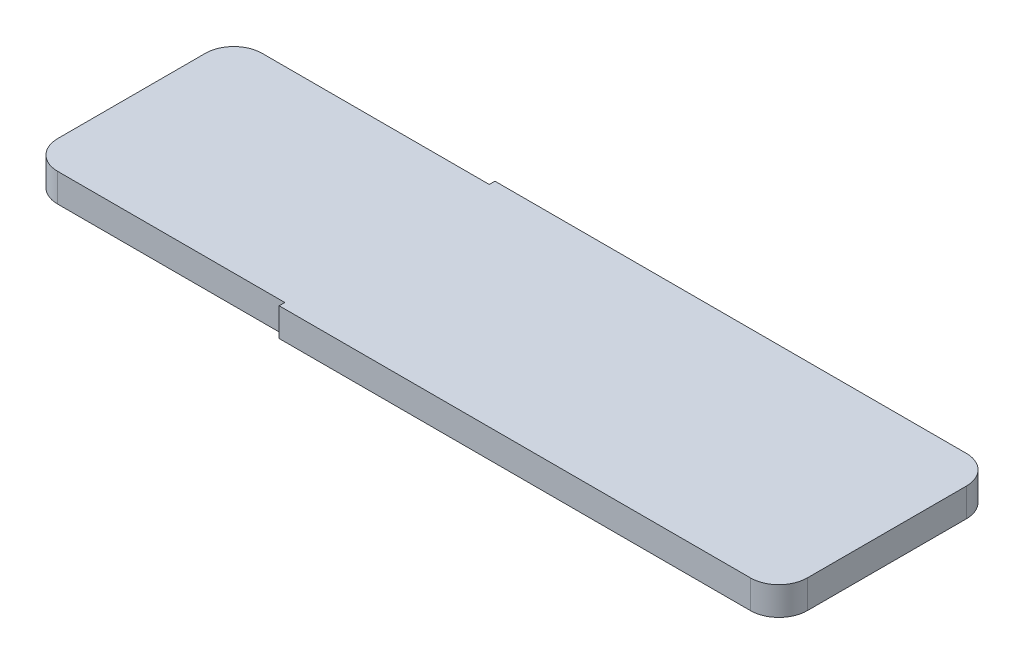
from build123d import *

# Parameters (mm, degrees)
EXTRUDE_473_DEPTH = 5
FILLET_R_R        = 10


with BuildPart() as part:
    # ｽｹｯﾁ1 → Extrude 473 (new, symmetric)
    with BuildSketch(Plane(origin=(0, 0, 0), x_dir=(1, 0, 0), z_dir=(0, 1, 0))):
        Polygon((-166, 36), (-76, 36), (-76, 38), (100, 38), (100, -38), (-76, -38), (-76, -36), (-166, -36), align=None)
    extrude(amount=EXTRUDE_473_DEPTH, both=True)

    # 外周 角R
    fillet_r_edges = [part.edges().sort_by_distance(p)[0] for p in [
        (-166, 0, -36),
        (100, 0, -38),
        (100, 0, 38),
        (-166, 0, 36),
    ]]
    fillet(fillet_r_edges, radius=FILLET_R_R)


solid = part.part
